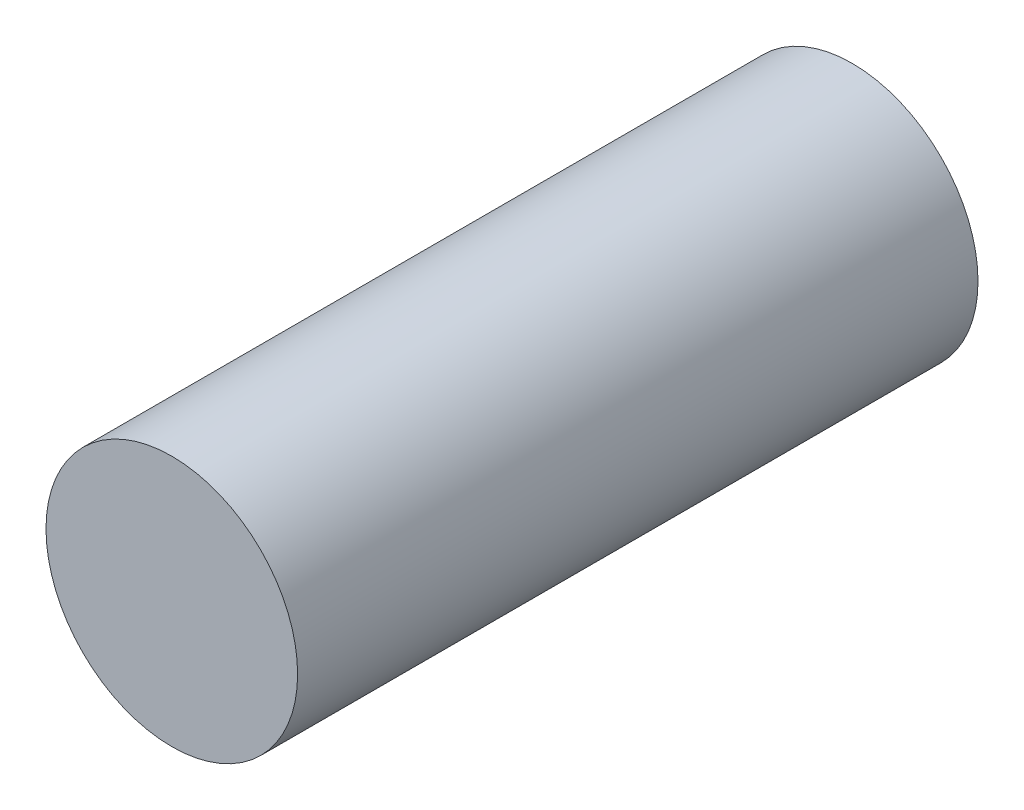
from build123d import *

# Parameters (mm, degrees)
SKETCH1_R           = 1.2446
BOSS_EXTRUDE1_DEPTH = 6.731


with BuildPart() as part:
    # Sketch1 → Boss-Extrude1 (new body)
    with BuildSketch(Plane.XY):
        Circle(SKETCH1_R)
    extrude(amount=BOSS_EXTRUDE1_DEPTH)


solid = part.part
